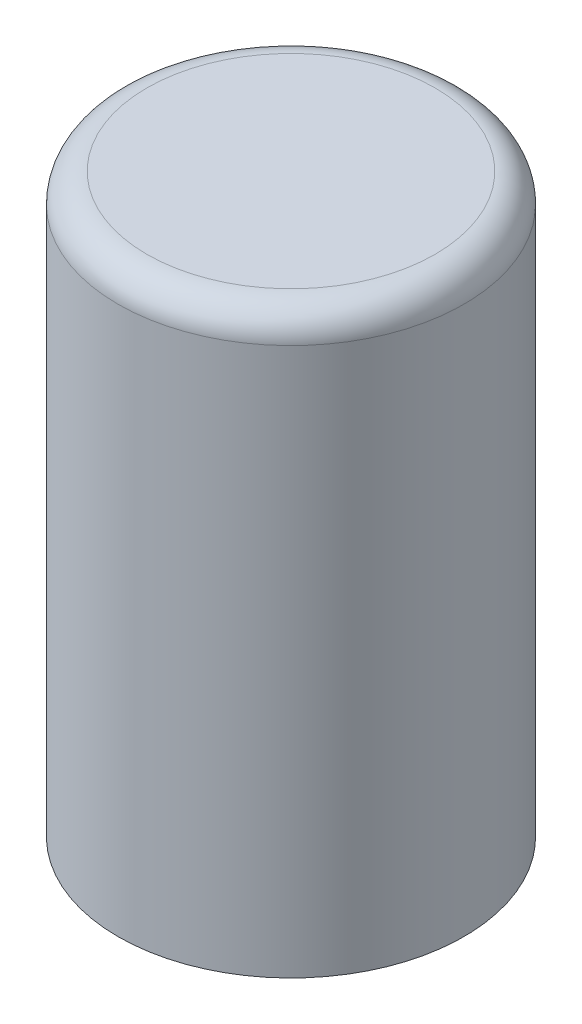
from build123d import *

# Parameters (mm, degrees)
SKETCH1_R           = 3
BOSS_EXTRUDE1_DEPTH = 10
SKETCH2_W           = 3
SKETCH2_H           = 2
CUT_EXTRUDE1_DEPTH  = 7
CHAMFER1_SIZE       = 0.5
FILLET1_R           = 0.5


with BuildPart() as part:
    # Sketch1 → Boss-Extrude1 (new body)
    with BuildSketch(Plane(origin=(0, 0, 0), x_dir=(1, 0, 0), z_dir=(0, 1, 0))):
        with Locations(Location((0, 0, 0), (0, 0, 270))):
            Circle(SKETCH1_R)
    extrude(amount=BOSS_EXTRUDE1_DEPTH)

    # Sketch2 → Cut-Extrude1 (cut)
    with BuildSketch(Plane.XZ):
        Rectangle(SKETCH2_W, SKETCH2_H)
    extrude(amount=-CUT_EXTRUDE1_DEPTH, mode=Mode.SUBTRACT)

    # Chamfer1
    chamfer1_edges = [part.edges().sort_by_distance(p)[0] for p in [
        (0, 0, -1),
        (0, 0, 1),
    ]]
    chamfer(chamfer1_edges, length=CHAMFER1_SIZE)

    # Fillet1
    fillet1_edges = [part.edges().sort_by_distance(p)[0] for p in [
        (0, 10, -3),
    ]]
    fillet(fillet1_edges, radius=FILLET1_R)


solid = part.part
